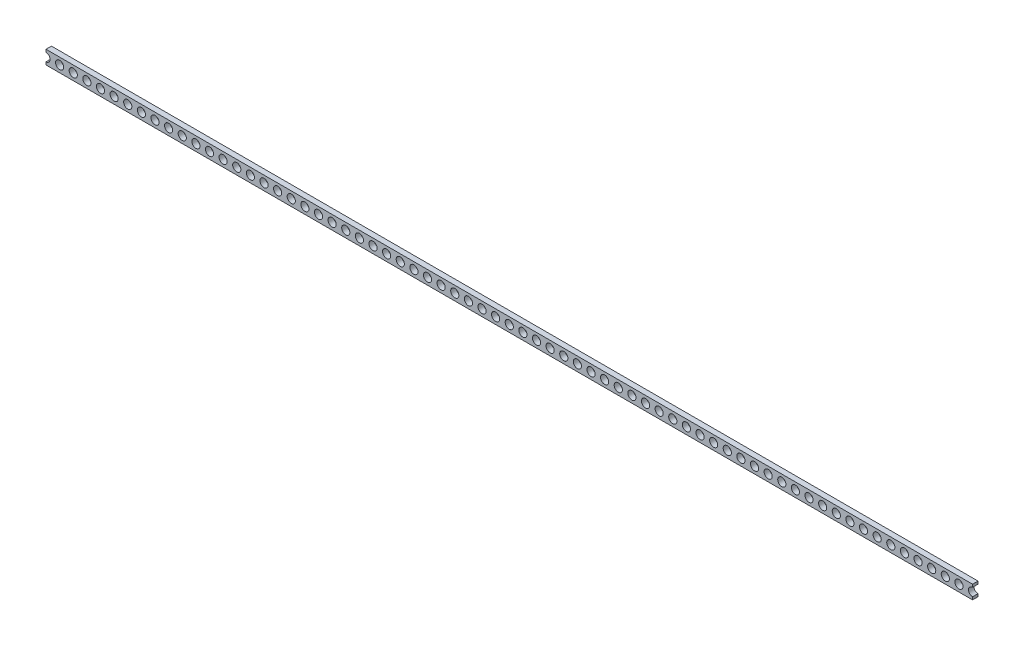
from build123d import *

# Parameters (mm, degrees)
SKETCH_1_W             = 340
SKETCH_1_H             = 5
EXTRUDE_1_DEPTH        = 2
SKETCH_2_R             = 1.5
CUT_EXTRUDE_1_DEPTH    = 341.042644384
PATTERN_LINEAR_1_COUNT = 35
PATTERN_LINEAR_1_PITCH = 5
PATTERN_LINEAR_2_COUNT = 35
PATTERN_LINEAR_2_PITCH = 5


with BuildPart() as part:
    # 草图1 → 凸台-拉伸1 (new body)
    with BuildSketch(Plane.XY):
        with Locations((170, -2.5)):
            Rectangle(SKETCH_1_W, SKETCH_1_H)
    extrude(amount=EXTRUDE_1_DEPTH)

    # 草图2 → 切除-拉伸1 (cut, through all)
    with BuildSketch(Plane.XY.offset(2)):
        with Locations((170, -2.5)):
            Circle(SKETCH_2_R)
    cut_extrude_1 = extrude(amount=-CUT_EXTRUDE_1_DEPTH, mode=Mode.SUBTRACT)

    # 阵列(线性)1: 切除-拉伸1 ×35
    with Locations(*[(i * PATTERN_LINEAR_1_PITCH, 0, 0) for i in range(1, PATTERN_LINEAR_1_COUNT)]):
        add(cut_extrude_1, mode=Mode.SUBTRACT)

    # 阵列(线性)2: 切除-拉伸1 ×35
    with Locations(*[(-i * PATTERN_LINEAR_2_PITCH, 0, 0) for i in range(1, PATTERN_LINEAR_2_COUNT)]):
        add(cut_extrude_1, mode=Mode.SUBTRACT)


solid = part.part
